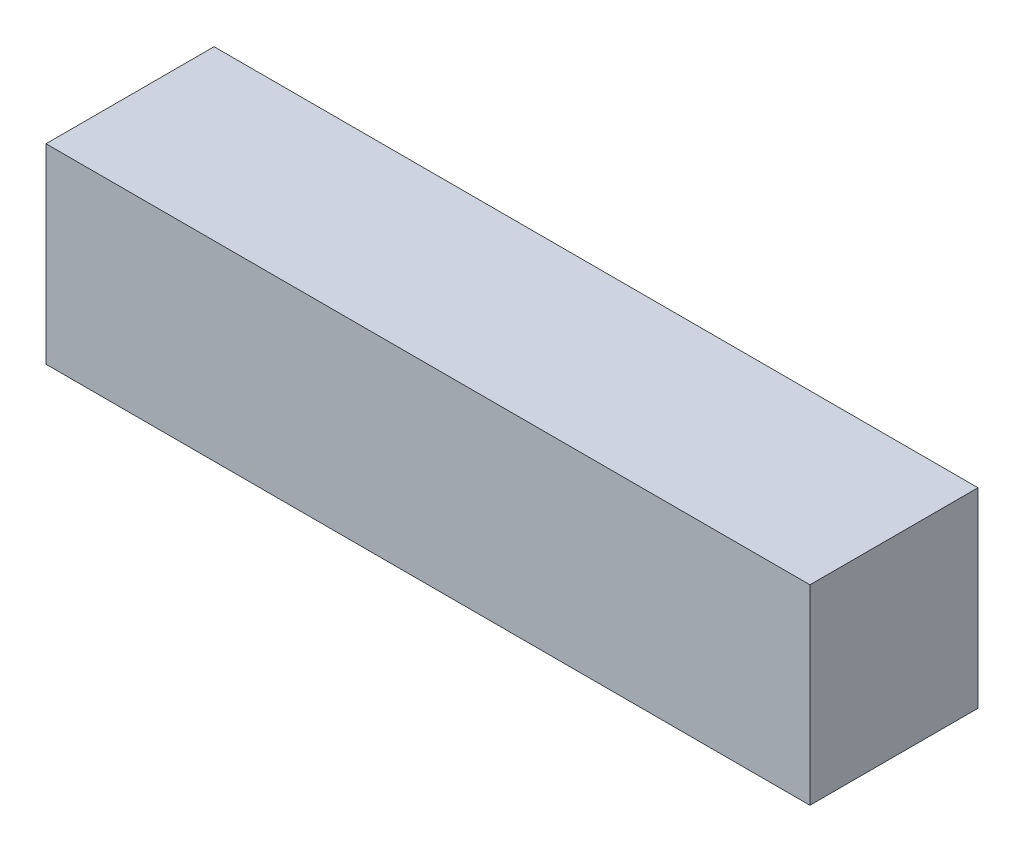
from build123d import *

# Parameters (mm, degrees)
SKETCH1_W           = 12.7
SKETCH1_H           = 3.175
BOSS_EXTRUDE1_DEPTH = 2.794


with BuildPart() as part:
    # Sketch1 → Boss-Extrude1 (new body)
    with BuildSketch(Plane.XY):
        with Locations((6.35, 1.5875)):
            Rectangle(SKETCH1_W, SKETCH1_H)
    extrude(amount=BOSS_EXTRUDE1_DEPTH)


solid = part.part
